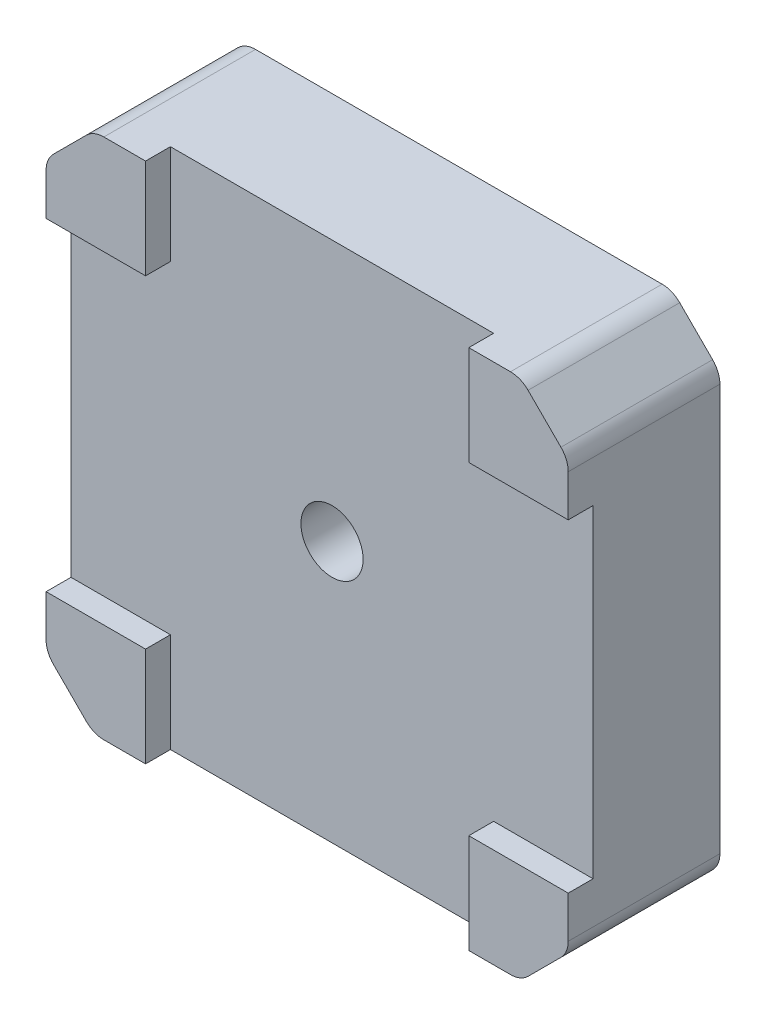
from build123d import *

# Parameters (mm, degrees)
BOSS_EXTRUDE1_DEPTH             = 12.2
SKETCH2_W                       = 2
SKETCH2_H                       = 26
CUT_EXTRUDE1_DEPTH              = 49.516388984
SKETCH3_W                       = 26
SKETCH3_H                       = 2
CUT_EXTRUDE2_DEPTH              = 49.516388984
SKETCH4_R                       = 16.5
CUT_EXTRUDE3_DEPTH              = 0.6
SKETCH5_R                       = 11
BOSS_EXTRUDE2_DEPTH             = 2.6
SKETCH6_R                       = 3.25
CUT_EXTRUDE4_DEPTH              = 2
SKETCH7_R                       = 2.5
CUT_EXTRUDE5_DEPTH              = 33.106697121
FILLET1_R                       = 0.5
FILLET3_R                       = 0.5
FILLET4_R                       = 2
M3X0_5_TAPPED_HOLE1_D           = 2.5
M3X0_5_TAPPED_HOLE1_DEPTH       = 10
M3X0_5_TAPPED_HOLE1_CSINK_D     = 3.5
M3X0_5_TAPPED_HOLE1_CSINK_ANGLE = 90
M3X0_5_TAPPED_HOLE1_TIP         = 0.751075774


with BuildPart() as part:
    # Sketch1 → Boss-Extrude1 (new body)
    with BuildSketch(Plane.XY):
        Polygon((-17.183766184, 21), (-21, 17.183766184), (-21, -17.183766184), (-17.183766184, -21), (17.183766184, -21), (21, -17.183766184), (21, 17.183766184), (17.183766184, 21), align=None)
    extrude(amount=BOSS_EXTRUDE1_DEPTH)

    # Sketch2 → Cut-Extrude1 (cut, through all)
    with BuildSketch(Plane(origin=(21, 0, 0), x_dir=(0, 0, -1), z_dir=(1, 0, 0))):
        with Locations((-11.2, 0)):
            Rectangle(SKETCH2_W, SKETCH2_H)
    extrude(amount=-CUT_EXTRUDE1_DEPTH, mode=Mode.SUBTRACT)

    # Sketch3 → Cut-Extrude2 (cut, through all)
    with BuildSketch(Plane(origin=(0, 21, 0), x_dir=(1, 0, 0), z_dir=(0, 1, 0))):
        with Locations((0, -11.2)):
            Rectangle(SKETCH3_W, SKETCH3_H)
    extrude(amount=-CUT_EXTRUDE2_DEPTH, mode=Mode.SUBTRACT)

    # Sketch4 → Cut-Extrude3 (cut)
    with BuildSketch(Plane(origin=(0, 0, 0), x_dir=(-1, 0, 0), z_dir=(0, 0, -1))):
        Circle(SKETCH4_R)
    extrude(amount=-CUT_EXTRUDE3_DEPTH, mode=Mode.SUBTRACT)

    # Sketch5 → Boss-Extrude2 (add)
    with BuildSketch(Plane(origin=(0, 0, 0.6), x_dir=(-1, 0, 0), z_dir=(0, 0, -1))):
        Circle(SKETCH5_R)
    extrude(amount=BOSS_EXTRUDE2_DEPTH)

    # Sketch6 → Cut-Extrude4 (cut)
    with BuildSketch(Plane(origin=(0, 0, -2), x_dir=(-1, 0, 0), z_dir=(0, 0, -1))):
        Circle(SKETCH6_R)
    extrude(amount=-CUT_EXTRUDE4_DEPTH, mode=Mode.SUBTRACT)

    # Sketch7 → Cut-Extrude5 (cut, through all)
    with BuildSketch(Plane(origin=(0, 0, 0), x_dir=(-1, 0, 0), z_dir=(0, 0, -1))):
        Circle(SKETCH7_R)
    extrude(amount=-CUT_EXTRUDE5_DEPTH, mode=Mode.SUBTRACT)

    # Fillet1
    fillet1_edges = [part.edges().sort_by_distance(p)[0] for p in [
        (3.25, 0, -2),
    ]]
    fillet(fillet1_edges, radius=FILLET1_R)

    # Fillet3
    fillet3_edges = [part.edges().sort_by_distance(p)[0] for p in [
        (11, 0, 0.6),
    ]]
    fillet(fillet3_edges, radius=FILLET3_R)

    # Fillet4
    fillet4_edges = [part.edges().sort_by_distance(p)[0] for p in [
        (17.183766184, 21, 6.1),
        (21, 17.183766184, 6.1),
        (21, -17.183766184, 6.1),
        (17.183766184, -21, 6.1),
        (-17.183766184, -21, 6.1),
        (-21, -17.183766184, 6.1),
        (-21, 17.183766184, 6.1),
        (-17.183766184, 21, 6.1),
    ]]
    fillet(fillet4_edges, radius=FILLET4_R)

    # M3x0.5 Tapped Hole1
    with Locations(Plane(origin=(0, 0, 0), x_dir=(-1, 0, 0), z_dir=(0, 0, -1))):
        with Locations((-15.5, -15.5), (-15.5, 15.5), (15.5, 15.5), (15.5, -15.5)):
            CounterSinkHole(M3X0_5_TAPPED_HOLE1_D / 2, M3X0_5_TAPPED_HOLE1_CSINK_D / 2, depth=M3X0_5_TAPPED_HOLE1_DEPTH, counter_sink_angle=M3X0_5_TAPPED_HOLE1_CSINK_ANGLE)
            with Locations((0, 0, -(M3X0_5_TAPPED_HOLE1_DEPTH + M3X0_5_TAPPED_HOLE1_TIP / 2))):  # 118° drill point
                Cone(0, M3X0_5_TAPPED_HOLE1_D / 2, M3X0_5_TAPPED_HOLE1_TIP, mode=Mode.SUBTRACT)


solid = part.part
